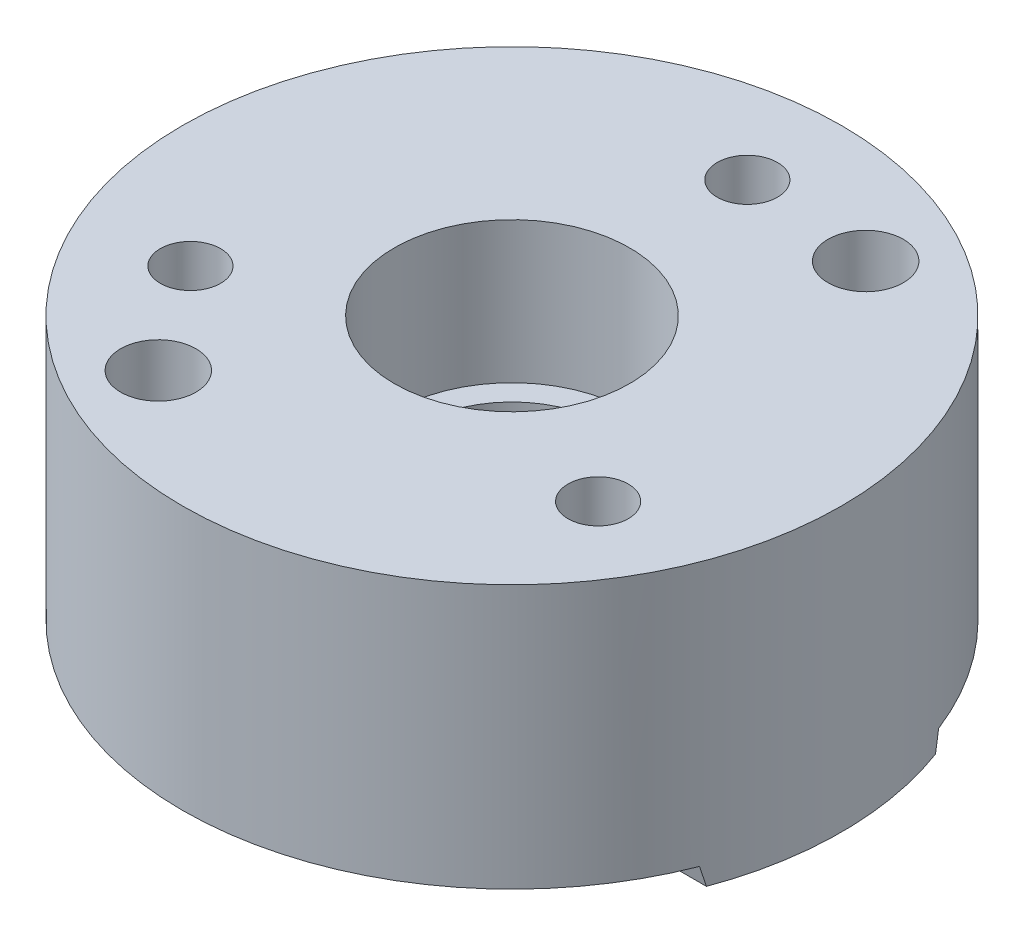
from build123d import *

# Parameters (mm, degrees)
SKETCH1_R                                           = 35
SKETCH1_R_2                                         = 10
BOSS_EXTRUDE1_DEPTH                                 = 30
SKETCH4_R                                           = 12.5
CUT_EXTRUDE2_DEPTH                                  = 15
CBORE_FOR_M6_HEX_SOCKET_HEAD_CAP_SCREW1_D           = 6.4
CBORE_FOR_M6_HEX_SOCKET_HEAD_CAP_SCREW1_CBORE_D     = 11
CBORE_FOR_M6_HEX_SOCKET_HEAD_CAP_SCREW1_CBORE_DEPTH = 8.4
F_8_0MM_DOWEL_HOLE1_D                               = 8
SKETCH14_OUTSIDE_W                                  = 92.688
SKETCH14_OUTSIDE_H                                  = 92.688
SKETCH14_OUTSIDE_W_2                                = 70
SKETCH14_OUTSIDE_H_2                                = 25.4
CUT_EXTRUDE3_DEPTH                                  = 2
SKETCH18_R                                          = 2.1
CUT_EXTRUDE5_DEPTH                                  = 3
CUT_EXTRUDE6_DEPTH                                  = 58.879184825
CUT_EXTRUDE6_DEPTH_BACK                             = 58.879184825
BOSS_EXTRUDE2_DEPTH                                 = 2
DRAFT1_ANGLE                                        = 3


with BuildPart() as part:
    # Sketch1 → Boss-Extrude1 (new body)
    with BuildSketch(Plane(origin=(0, 0, 0), x_dir=(1, 0, 0), z_dir=(0, 1, 0))):
        with Locations(Location((0, 0, 0), (0, 0, 270))):
            Circle(SKETCH1_R)
        with Locations(Location((0, 0, 0), (0, 0, 270))):
            Circle(SKETCH1_R_2, mode=Mode.SUBTRACT)
    extrude(amount=-BOSS_EXTRUDE1_DEPTH)

    # Sketch4 → Cut-Extrude2 (cut)
    with BuildSketch(Plane(origin=(0, 0, 0), x_dir=(1, 0, 0), z_dir=(0, 1, 0))):
        with Locations(Location((0, 0, 0), (0, 0, 270))):
            Circle(SKETCH4_R)
    extrude(amount=-CUT_EXTRUDE2_DEPTH, mode=Mode.SUBTRACT)

    # CBORE for M6 Hex Socket Head Cap Screw1 (through all)
    with Locations(Plane(origin=(0, -30, 0), x_dir=(-1, 0, 0), z_dir=(0, -1, 0))):
        with Locations((0, 25), (21.650635095, -12.5), (-21.650635095, -12.5)):
            CounterBoreHole(CBORE_FOR_M6_HEX_SOCKET_HEAD_CAP_SCREW1_D / 2, CBORE_FOR_M6_HEX_SOCKET_HEAD_CAP_SCREW1_CBORE_D / 2, CBORE_FOR_M6_HEX_SOCKET_HEAD_CAP_SCREW1_CBORE_DEPTH)

    # Ø8.0mm Dowel Hole1 (through all)
    with Locations(Plane(origin=(0, -30, 0), x_dir=(-1, 0, 0), z_dir=(0, -1, 0))):
        with Locations((13.75, -23.815698604), (-13.75, 23.815698604)):
            Hole(F_8_0MM_DOWEL_HOLE1_D / 2)

    # Sketch14 outside → Cut-Extrude3 (cut)
    with BuildSketch(Plane.XZ.offset(30)):
        Rectangle(SKETCH14_OUTSIDE_W, SKETCH14_OUTSIDE_H)
        Rectangle(SKETCH14_OUTSIDE_W_2, SKETCH14_OUTSIDE_H_2, mode=Mode.SUBTRACT)
    extrude(amount=-CUT_EXTRUDE3_DEPTH, mode=Mode.SUBTRACT)

    # Sketch18 → Cut-Extrude5 (cut)
    with BuildSketch(Plane.XZ.offset(30)):
        with Locations(Location((-13.665, 0, 0), (0, 0, 270))):
            Circle(SKETCH18_R)
    extrude(amount=-CUT_EXTRUDE5_DEPTH, mode=Mode.SUBTRACT)

    # Sketch19 → Cut-Extrude6 (cut, two sides: drawn at the far end of the back side and taken through both)
    with BuildSketch(Plane(origin=(0, 0, 0), x_dir=(0, 0, -1), z_dir=(1, 0, 0)).offset(-CUT_EXTRUDE6_DEPTH_BACK)):
        Polygon((-12.7, -28), (-12.164101615, -30), (-12.7, -30), align=None)
        Polygon((12.7, -28), (12.164101615, -30), (12.7, -30), align=None)
    extrude(amount=CUT_EXTRUDE6_DEPTH + CUT_EXTRUDE6_DEPTH_BACK, mode=Mode.SUBTRACT)

    # Sketch20 → Boss-Extrude2 (add)
    with BuildSketch(Plane.XZ.offset(30)):
        with BuildLine():
            Line((-12.581122044, 12.164101615), (12.581122044, 12.164101615))
            ThreePointArc((12.581122044, 12.164101615), (0, 17.5), (-12.581122044, 12.164101615))
        make_face()
        with BuildLine():
            Line((-12.581122044, -12.164101615), (12.581122044, -12.164101615))
            ThreePointArc((12.581122044, -12.164101615), (0, -17.5), (-12.581122044, -12.164101615))
        make_face()
    extrude(amount=-BOSS_EXTRUDE2_DEPTH)

    # Draft1
    draft1_faces = [part.faces().sort_by_distance(p)[0] for p in [
        (0, -29, -17.5),
    ]]
    draft(draft1_faces, Plane(origin=(0, -28, 0), x_dir=(0, 0, -1), z_dir=(0, -1, 0)), DRAFT1_ANGLE)


solid = part.part
